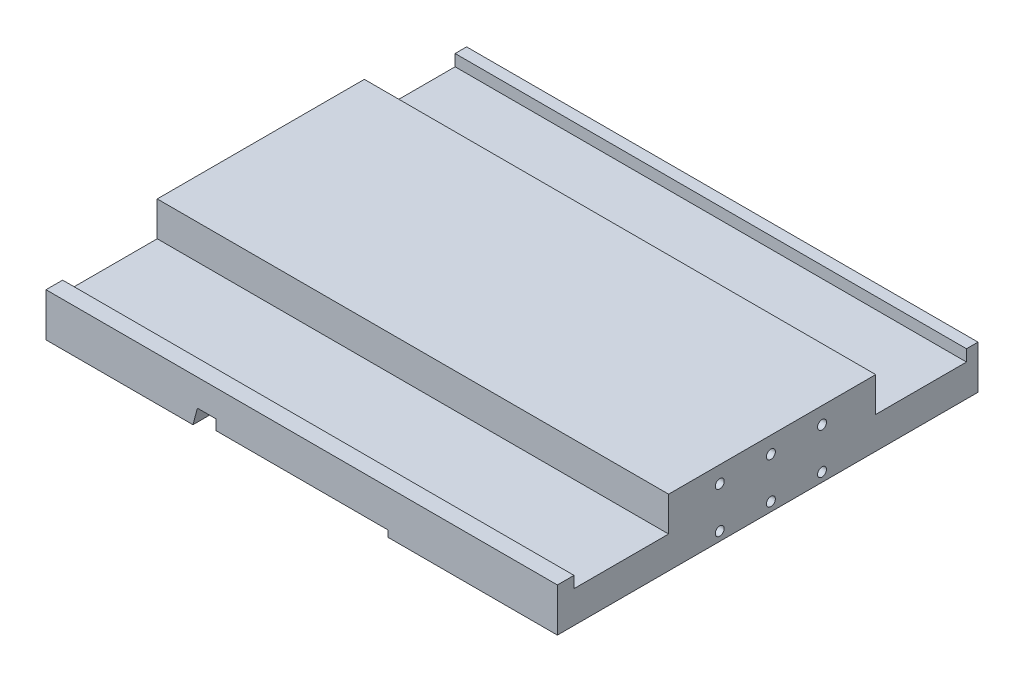
from build123d import *

# Parameters (mm, degrees)
SKETCH_1_W           = 400
SKETCH_1_H           = 329
EXTRUDE_1_DEPTH      = 25
SKETCH_2_W           = 400
SKETCH_2_H           = 162
EXTRUDE_2_DEPTH      = 27
SKETCH_4_W           = 400
SKETCH_4_H           = 9
SKETCH_4_H_2         = 13
EXTRUDE_3_DEPTH      = 9
CUT_EXTRUDE_3_DEPTH  = 400
SKETCH_10_R          = 2
CUT_EXTRUDE_8_DEPTH  = 9.03
EXTRUDE_START        = 0.07
SKETCH_12_W          = 14.540639504
SKETCH_12_H          = 329
SKETCH_12_R          = 2
EXTRUDE_4_DEPTH      = 0.07
EXTRUDE_5_DEPTH      = 329
SKETCH_15_R          = 3.5
CUT_EXTRUDE_10_DEPTH = 22


with BuildPart() as part:
    # 草图1 → 凸台-拉伸1 (new body)
    with BuildSketch(Plane(origin=(0, 0, 0), x_dir=(1, 0, 0), z_dir=(0, 1, 0))):
        with Locations((200, 164.5)):
            Rectangle(SKETCH_1_W, SKETCH_1_H)
    extrude(amount=EXTRUDE_1_DEPTH)

    # 草图2 → 凸台-拉伸2 (add)
    with BuildSketch(Plane(origin=(0, 25, 0), x_dir=(1, 0, 0), z_dir=(0, 1, 0))):
        with Locations((200, 168)):
            Rectangle(SKETCH_2_W, SKETCH_2_H)
    extrude(amount=EXTRUDE_2_DEPTH)

    # 草图4 → 凸台-拉伸3 (add)
    with BuildSketch(Plane(origin=(0, 25, 0), x_dir=(1, 0, 0), z_dir=(0, 1, 0))):
        with Locations((200, 324.5)):
            Rectangle(SKETCH_4_W, SKETCH_4_H)
        with Locations((200, 6.5)):
            Rectangle(SKETCH_4_W, SKETCH_4_H_2)
    extrude(amount=EXTRUDE_3_DEPTH)

    # 草图8 → 切除-拉伸3 (cut)
    with BuildSketch(Plane(origin=(0, 0, -329), x_dir=(-1, 0, 0), z_dir=(0, 0, -1))):
        Polygon((-267.5, 5), (-267.5, 0), (-114.958104289, 0), (-118.459360496, 13.066866054), (-133, 13.066866054), (-133, 5), align=None)
    extrude(amount=-CUT_EXTRUDE_3_DEPTH, mode=Mode.SUBTRACT)

    # 草图10 → 切除-拉伸8 (cut)
    with BuildSketch(Plane.XZ.offset(-13.066866054)):
        with Locations(Location((124.5, -37, 0), (0, 0, 270))):
            Circle(SKETCH_10_R)
        with Locations(Location((124.5, -63, 0), (0, 0, 270))):
            Circle(SKETCH_10_R)
        with Locations(Location((124.5, -89, 0), (0, 0, 270))):
            Circle(SKETCH_10_R)
        with Locations(Location((124.5, -115, 0), (0, 0, 270))):
            Circle(SKETCH_10_R)
        with Locations(Location((124.5, -141, 0), (0, 0, 270))):
            Circle(SKETCH_10_R)
        with Locations(Location((124.5, -167, 0), (0, 0, 270))):
            Circle(SKETCH_10_R)
        with Locations(Location((124.5, -193, 0), (0, 0, 270))):
            Circle(SKETCH_10_R)
        with Locations(Location((124.5, -219, 0), (0, 0, 270))):
            Circle(SKETCH_10_R)
        with Locations(Location((124.5, -245, 0), (0, 0, 270))):
            Circle(SKETCH_10_R)
    extrude(amount=-CUT_EXTRUDE_8_DEPTH, mode=Mode.SUBTRACT)

    # 草图12 → 凸台-拉伸4 (add)
    with BuildSketch(Plane.XZ.offset(-13.066866054).offset(EXTRUDE_START)):
        with Locations((125.729680248, -164.5)):
            Rectangle(SKETCH_12_W, SKETCH_12_H)
        with Locations(Location((124.5, -63, 0), (0, 0, 270))):
            Circle(SKETCH_12_R, mode=Mode.SUBTRACT)
        with Locations(Location((124.5, -115, 0), (0, 0, 270))):
            Circle(SKETCH_12_R, mode=Mode.SUBTRACT)
        with Locations(Location((124.5, -167, 0), (0, 0, 270))):
            Circle(SKETCH_12_R, mode=Mode.SUBTRACT)
        with Locations(Location((124.5, -219, 0), (0, 0, 270))):
            Circle(SKETCH_12_R, mode=Mode.SUBTRACT)
        with Locations(Location((124.5, -245, 0), (0, 0, 270))):
            Circle(SKETCH_12_R, mode=Mode.SUBTRACT)
        with Locations(Location((124.5, -193, 0), (0, 0, 270))):
            Circle(SKETCH_12_R, mode=Mode.SUBTRACT)
        with Locations(Location((124.5, -141, 0), (0, 0, 270))):
            Circle(SKETCH_12_R, mode=Mode.SUBTRACT)
        with Locations(Location((124.5, -89, 0), (0, 0, 270))):
            Circle(SKETCH_12_R, mode=Mode.SUBTRACT)
        with Locations(Location((124.5, -37, 0), (0, 0, 270))):
            Circle(SKETCH_12_R, mode=Mode.SUBTRACT)
    extrude(amount=-EXTRUDE_4_DEPTH)

    # 草图13 → 凸台-拉伸5 (add)
    with BuildSketch(Plane.XY):
        Polygon((118.459360496, 13.066866054), (118.459360496, 12.996866054), (118.440604053, 12.996866054), align=None)
    extrude(amount=-EXTRUDE_5_DEPTH)

    # 草图15 → 切除-拉伸10 (cut)
    with BuildSketch(Plane(origin=(400, 0, 0), x_dir=(0, 0, -1), z_dir=(1, 0, 0))):
        with Locations((207, 39.026793109)):
            Circle(SKETCH_15_R)
        with Locations((207, 7.026793109)):
            Circle(SKETCH_15_R)
        with Locations((167, 39.026793109)):
            Circle(SKETCH_15_R)
        with Locations((167, 7.026793109)):
            Circle(SKETCH_15_R)
        with Locations((127, 39.026793109)):
            Circle(SKETCH_15_R)
        with Locations((127, 7.026793109)):
            Circle(SKETCH_15_R)
    extrude(amount=-CUT_EXTRUDE_10_DEPTH, mode=Mode.SUBTRACT)


solid = part.part
